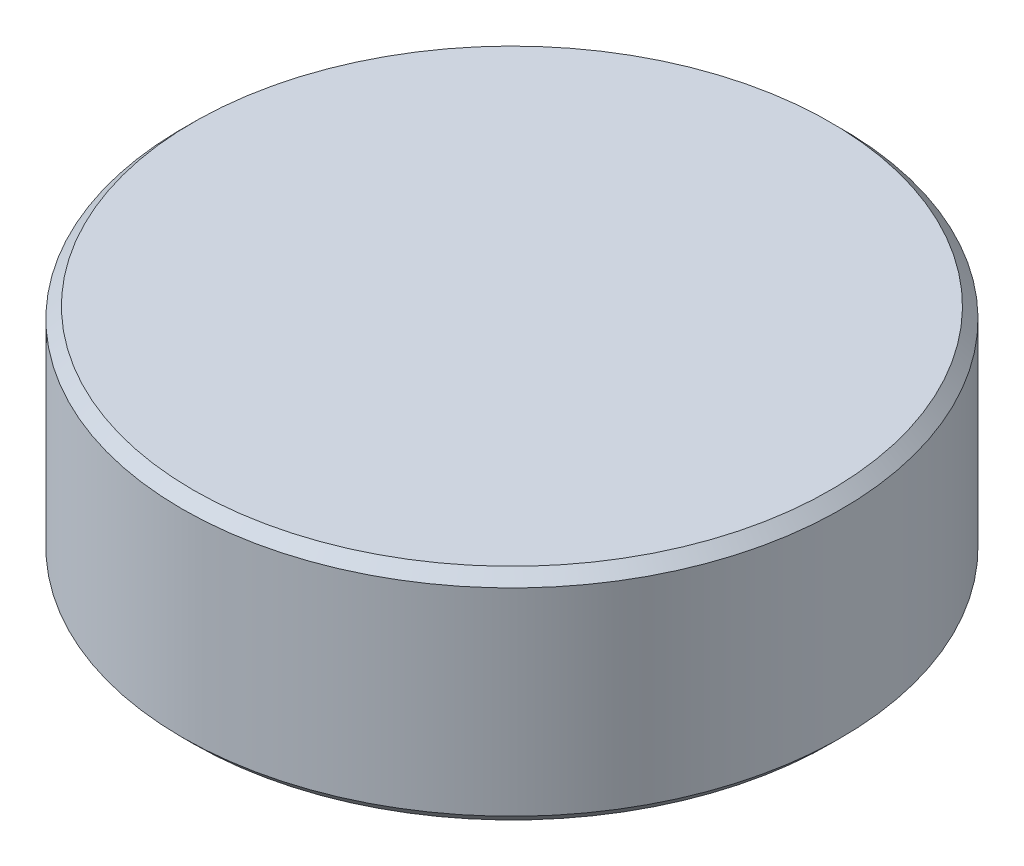
from build123d import *

# Parameters (mm, degrees)
SKETCH1_R           = 3
BOSS_EXTRUDE1_DEPTH = 2
CHAMFER1_SIZE       = 0.1


with BuildPart() as part:
    # Sketch1 → Boss-Extrude1 (new body)
    with BuildSketch(Plane(origin=(0, 0, 0), x_dir=(1, 0, 0), z_dir=(0, 1, 0))):
        with Locations(Location((0, 0, 0), (0, 0, 270))):
            Circle(SKETCH1_R)
    extrude(amount=BOSS_EXTRUDE1_DEPTH)

    # Chamfer1
    chamfer1_edges = [part.edges().sort_by_distance(p)[0] for p in [
        (0, 0, -3),
        (0, 2, -3),
    ]]
    chamfer(chamfer1_edges, length=CHAMFER1_SIZE)


solid = part.part
